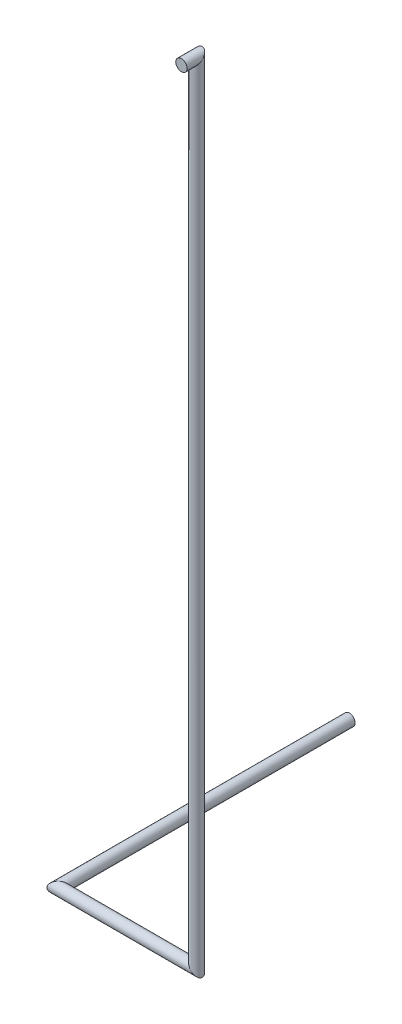
from build123d import *

# Parameters (mm, degrees)
ESQUISSE2_R = 7.5


with BuildPart() as part:
    # Balayage1: sweep along a curve in space
    with BuildLine() as balayage1_path:
        Line((0, 0, 0), (0, 0, -20))
        Line((0, 0, -20), (0, -1038, -20))
        Line((0, -1038, -20), (-182, -1038, -20))
        Line((-182, -1038, -20), (-182, -1038, -403))
    # Esquisse2 → Balayage1 (sweep)
    with BuildSketch(Plane.XY):
        Circle(ESQUISSE2_R)
    sweep(path=balayage1_path.line, transition=Transition.RIGHT)


solid = part.part
